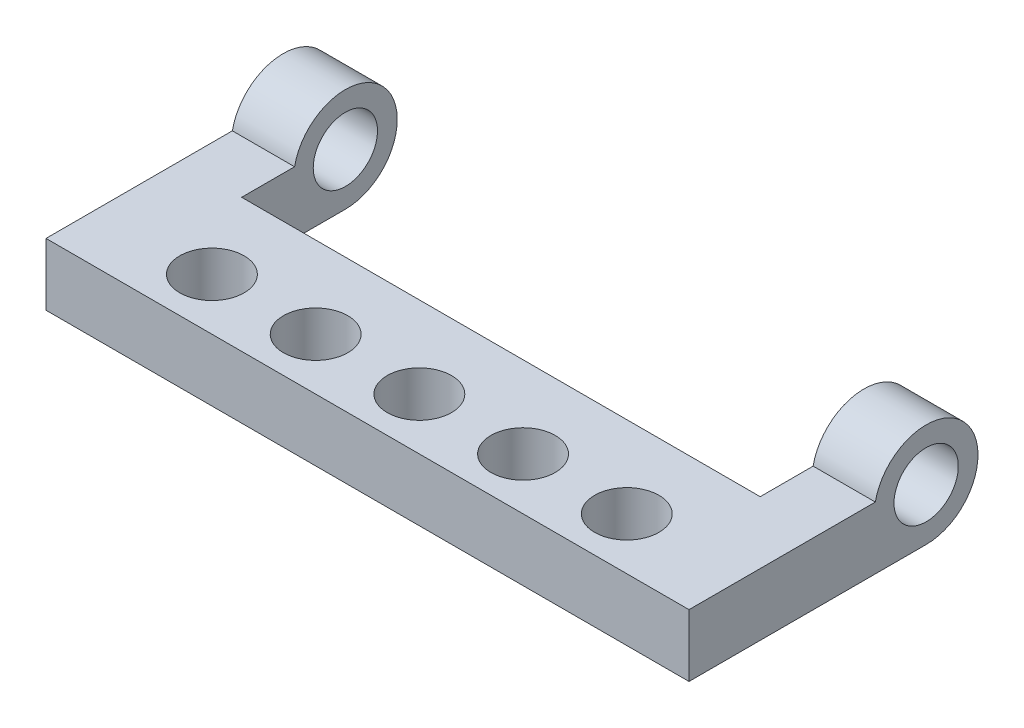
from build123d import *

# Parameters (mm, degrees)
SKETCH1_W           = 31
SKETCH1_H           = 11.43285124
SKETCH1_R           = 1.55
BOSS_EXTRUDE1_DEPTH = 3
SKETCH2_R           = 1.55
CUT_EXTRUDE1_DEPTH  = 31
SKETCH2_3_R         = 2.5
SKETCH2_3_R_2       = 1.55
BOSS_EXTRUDE2_DEPTH = 31
SKETCH3_W           = 25
SKETCH3_H           = 7.5
CUT_EXTRUDE2_DEPTH  = 19.241700852


with BuildPart() as part:
    # Sketch1 → Boss-Extrude1 (new body)
    with BuildSketch(Plane(origin=(0, 0, 0), x_dir=(1, 0, 0), z_dir=(0, 1, 0))):
        Rectangle(SKETCH1_W, SKETCH1_H)
        with Locations(Location((0, -3.21642562, 0), (0, 0, 270))):
            Circle(SKETCH1_R, mode=Mode.SUBTRACT)
        with Locations(Location((5, -3.21642562, 0), (0, 0, 270))):
            Circle(SKETCH1_R, mode=Mode.SUBTRACT)
        with Locations(Location((10, -3.21642562, 0), (0, 0, 270))):
            Circle(SKETCH1_R, mode=Mode.SUBTRACT)
        with Locations(Location((-5, -3.21642562, 0), (0, 0, 270))):
            Circle(SKETCH1_R, mode=Mode.SUBTRACT)
        with Locations(Location((-10, -3.21642562, 0), (0, 0, 270))):
            Circle(SKETCH1_R, mode=Mode.SUBTRACT)
    extrude(amount=BOSS_EXTRUDE1_DEPTH)

    # Sketch2 → Cut-Extrude1 (cut)
    with BuildSketch(Plane.ZY.offset(15.5)):
        with Locations((-5.71642562, 2.5)):
            Circle(SKETCH2_R)
    extrude(amount=-CUT_EXTRUDE1_DEPTH, mode=Mode.SUBTRACT)

    # Sketch2<3> → Boss-Extrude2 (add)
    with BuildSketch(Plane.ZY.offset(15.5)):
        with Locations((-5.71642562, 2.5)):
            Circle(SKETCH2_3_R)
        with Locations((-5.71642562, 2.5)):
            Circle(SKETCH2_3_R_2, mode=Mode.SUBTRACT)
    extrude(amount=-BOSS_EXTRUDE2_DEPTH)

    # Sketch3 → Cut-Extrude2 (cut, through all)
    with BuildSketch(Plane.XZ):
        with Locations((0, -4.46642562)):
            Rectangle(SKETCH3_W, SKETCH3_H)
    extrude(amount=-CUT_EXTRUDE2_DEPTH, mode=Mode.SUBTRACT)


solid = part.part
